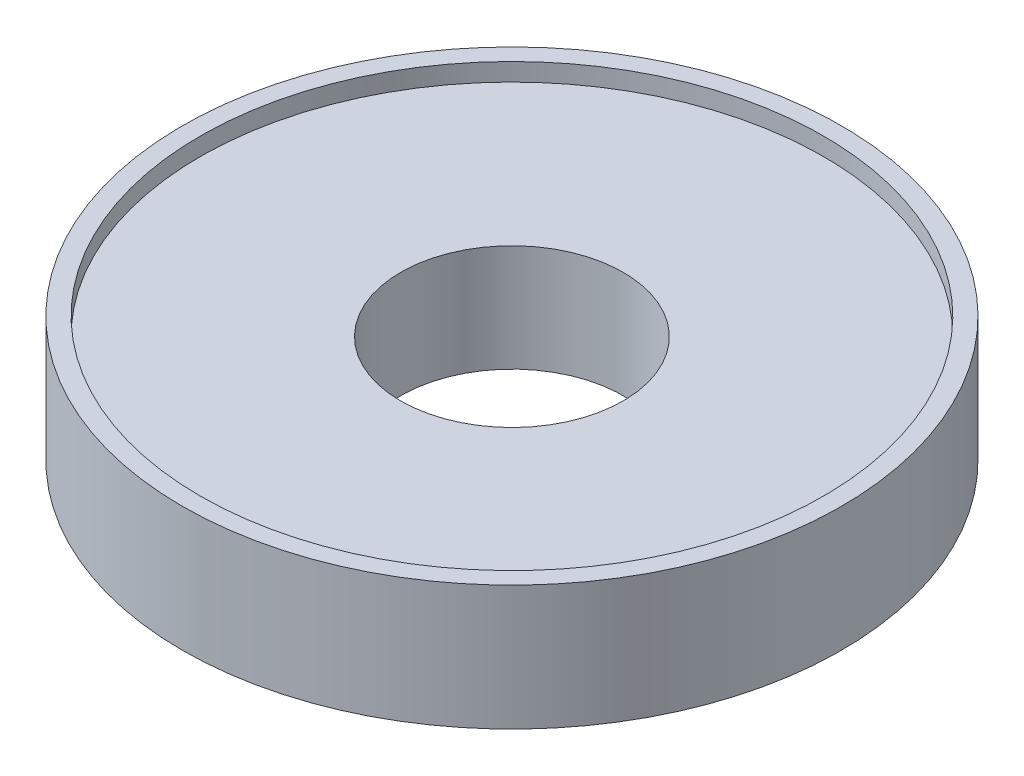
from build123d import *

# Parameters (mm, degrees)
SKETCH1_R              = 18.5
BOSS_EXTRUDE1_DEPTH    = 6
SKETCH2_R              = 18.5
SKETCH2_R_2            = 17.5
BOSS_EXTRUDE2_DEPTH    = 1
M14X1_5_TAPPED_HOLE1_D = 12.5
SKETCH5_R              = 1.5
CUT_EXTRUDE1_DEPTH     = 4


with BuildPart() as part:
    # Sketch1 → Boss-Extrude1 (new body)
    with BuildSketch(Plane(origin=(0, 0, 0), x_dir=(1, 0, 0), z_dir=(0, 1, 0))):
        with Locations(Location((0, 0, 0), (0, 0, 270))):
            Circle(SKETCH1_R)
    extrude(amount=BOSS_EXTRUDE1_DEPTH)

    # Sketch2 → Boss-Extrude2 (add)
    with BuildSketch(Plane(origin=(0, 6, 0), x_dir=(1, 0, 0), z_dir=(0, 1, 0))):
        with Locations(Location((0, 0, 0), (0, 0, 270))):
            Circle(SKETCH2_R)
        with Locations(Location((0, 0, 0), (0, 0, 270))):
            Circle(SKETCH2_R_2, mode=Mode.SUBTRACT)
    extrude(amount=BOSS_EXTRUDE2_DEPTH)

    # M14x1.5 Tapped Hole1 (through all)
    with Locations(Plane(origin=(0, 6, 0), x_dir=(1, 0, 0), z_dir=(0, 1, 0))):
        with Locations((0, 0)):
            Hole(M14X1_5_TAPPED_HOLE1_D / 2)

    # Sketch5 → Cut-Extrude1 (cut)
    with BuildSketch(Plane.XZ):
        with Locations(Location((-10.606601718, 10.606601718, 0), (0, 0, 270))):
            Circle(SKETCH5_R)
        with Locations(Location((10.606601718, 10.606601718, 0), (0, 0, 270))):
            Circle(SKETCH5_R)
        with Locations(Location((10.606601718, -10.606601718, 0), (0, 0, 270))):
            Circle(SKETCH5_R)
        with Locations(Location((-10.606601718, -10.606601718, 0), (0, 0, 270))):
            Circle(SKETCH5_R)
    extrude(amount=-CUT_EXTRUDE1_DEPTH, mode=Mode.SUBTRACT)


solid = part.part
